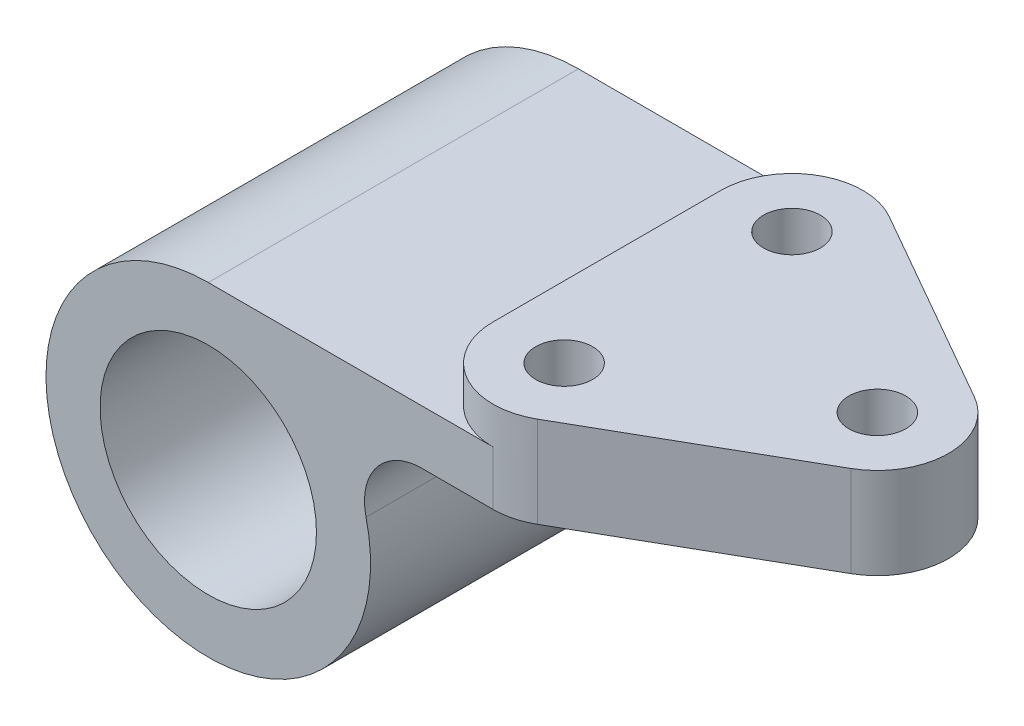
from build123d import *

# Parameters (mm, degrees)
SKETCH1_R           = 19
BOSS_EXTRUDE1_DEPTH = 32.5
BOSS_EXTRUDE2_START = -9.5
SKETCH2_R           = 5
BOSS_EXTRUDE2_DEPTH = 16
CUT_EXTRUDE2_START  = -16
SKETCH4_R           = 5
CUT_EXTRUDE2_DEPTH  = 16


with BuildPart() as part:
    # Sketch1 → Boss-Extrude1 (new, symmetric)
    with BuildSketch(Plane.XY):
        with BuildLine():
            Line((37.433273968, 19), (50, 19))
            Line((50, 19), (50, 28.5))
            Line((50, 28.5), (0, 28.5))
            ThreePointArc((0, 28.5), (-17.640484356, -22.38444352), (27.710345665, 6.662337662))
            ThreePointArc((27.710345665, 6.662337662), (29.57908326, 15.189643634), (37.433273968, 19))
        make_face()
        Circle(SKETCH1_R, mode=Mode.SUBTRACT)
    extrude(amount=BOSS_EXTRUDE1_DEPTH, both=True)

    # Sketch2 → Boss-Extrude2 (add)
    with BuildSketch(Plane(origin=(0, 28.5, 0), x_dir=(1, 0, 0), z_dir=(0, 1, 0)).offset(BOSS_EXTRUDE2_START)):
        with BuildLine():
            Line((37.5, 20), (37.5, -20))
            ThreePointArc((37.5, -20), (43.725914773, -30.811376164), (56.201736729, -30.853039277))
            Line((56.201736729, -30.853039277), (91.201736729, -10.853039277))
            ThreePointArc((91.201736729, -10.853039277), (97.5, 0), (91.201736729, 10.853039277))
            Line((91.201736729, 10.853039277), (56.201736729, 30.853039277))
            ThreePointArc((56.201736729, 30.853039277), (43.725914773, 30.811376164), (37.5, 20))
        make_face()
        with Locations(Location((50, 20, 0), (0, 0, 270))):
            Circle(SKETCH2_R, mode=Mode.SUBTRACT)
        with Locations(Location((50, -20, 0), (0, 0, 270))):
            Circle(SKETCH2_R, mode=Mode.SUBTRACT)
        with Locations(Location((85, 0, 0), (0, 0, 270))):
            Circle(SKETCH2_R, mode=Mode.SUBTRACT)
    extrude(amount=BOSS_EXTRUDE2_DEPTH)

    # Sketch4 → Cut-Extrude2 (cut)
    with BuildSketch(Plane(origin=(0, 35, 0), x_dir=(1, 0, 0), z_dir=(0, 1, 0)).offset(CUT_EXTRUDE2_START)):
        with Locations(Location((50, -20, 0), (0, 0, 270))):
            Circle(SKETCH4_R)
        with Locations(Location((85, 0, 0), (0, 0, 270))):
            Circle(SKETCH4_R)
        with Locations(Location((50, 20, 0), (0, 0, 270))):
            Circle(SKETCH4_R)
    extrude(amount=CUT_EXTRUDE2_DEPTH, mode=Mode.SUBTRACT)


solid = part.part
